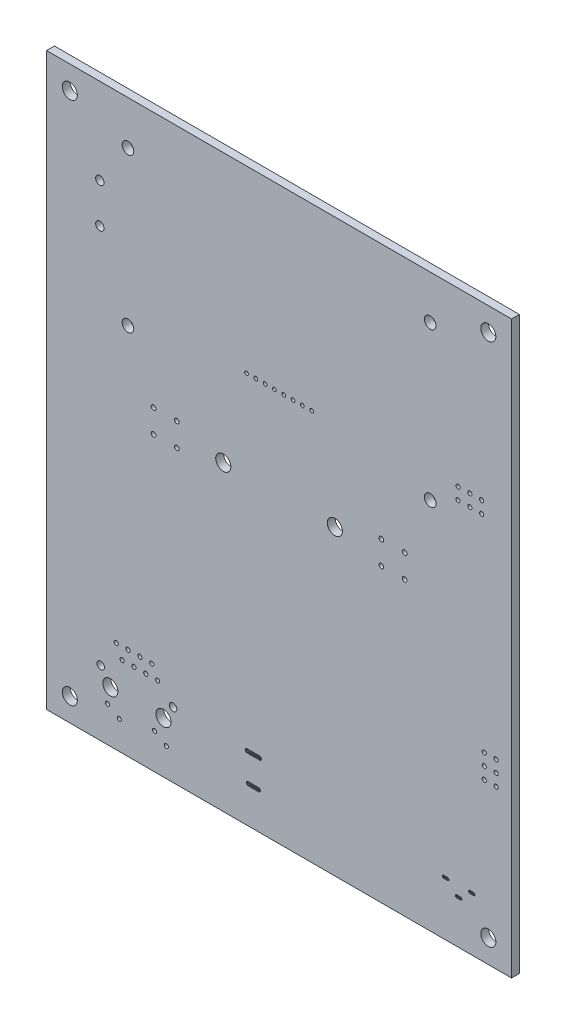
from build123d import *

# Parameters (mm, degrees)
SKETCH1_W           = 100
SKETCH1_H           = 122.75
SKETCH1_R           = 1.62500056
SKETCH1_R_2         = 0.4499991
SKETCH1_R_3         = 1.25000004
SKETCH1_R_4         = 0.3999992
SKETCH1_R_5         = 0.499999
SKETCH1_R_6         = 0.8999982
SKETCH1_R_7         = 0.7999984
SKETCH1_R_8         = 0.44500038
BOSS_EXTRUDE1_DEPTH = 1.69164


with BuildPart() as part:
    # Sketch1 → Boss-Extrude1 (new body)
    with BuildSketch(Plane(origin=(0, 0, 0), x_dir=(-1, 0, 0), z_dir=(0, 0, -1))):
        with Locations((50, 61.375)):
            Rectangle(SKETCH1_W, SKETCH1_H)
        with Locations(Location((4.99999762, 117.75000072, 0), (0, 0, 180))):
            Circle(SKETCH1_R, mode=Mode.SUBTRACT)
        with Locations(Location((6.42639812, 85.78000116, 0), (0, 0, 180))):
            Circle(SKETCH1_R_2, mode=Mode.SUBTRACT)
        with Locations(Location((6.42639812, 83.24000116, 0), (0, 0, 180))):
            Circle(SKETCH1_R_2, mode=Mode.SUBTRACT)
        with Locations(Location((8.96639812, 85.78000116, 0), (0, 0, 180))):
            Circle(SKETCH1_R_2, mode=Mode.SUBTRACT)
        with Locations(Location((11.50639812, 85.78000116, 0), (0, 0, 180))):
            Circle(SKETCH1_R_2, mode=Mode.SUBTRACT)
        with Locations(Location((11.50639812, 83.24000116, 0), (0, 0, 180))):
            Circle(SKETCH1_R_2, mode=Mode.SUBTRACT)
        with Locations(Location((3.32759812, 39.06940116, 0), (0, 0, 180))):
            Circle(SKETCH1_R_2, mode=Mode.SUBTRACT)
        with Locations(Location((5.86759812, 39.06940116, 0), (0, 0, 180))):
            Circle(SKETCH1_R_2, mode=Mode.SUBTRACT)
        with Locations(Location((3.32759812, 36.52940116, 0), (0, 0, 180))):
            Circle(SKETCH1_R_2, mode=Mode.SUBTRACT)
        with Locations(Location((5.86759812, 36.52940116, 0), (0, 0, 180))):
            Circle(SKETCH1_R_2, mode=Mode.SUBTRACT)
        with Locations(Location((8.96639812, 83.24000116, 0), (0, 0, 180))):
            Circle(SKETCH1_R_2, mode=Mode.SUBTRACT)
        with Locations(Location((5.86759812, 33.98940116, 0), (0, 0, 180))):
            Circle(SKETCH1_R_2, mode=Mode.SUBTRACT)
        with Locations(Location((17.49999802, 113.3500019, 0), (0, 0, 180))):
            Circle(SKETCH1_R_3, mode=Mode.SUBTRACT)
        with Locations(Location((43.00000036, 84.15000188, 0), (0, 0, 180))):
            Circle(SKETCH1_R_4, mode=Mode.SUBTRACT)
        with Locations(Location((44.9999989, 84.15000188, 0), (0, 0, 180))):
            Circle(SKETCH1_R_4, mode=Mode.SUBTRACT)
        with Locations(Location((48.99999852, 84.15000188, 0), (0, 0, 180))):
            Circle(SKETCH1_R_4, mode=Mode.SUBTRACT)
        with Locations(Location((50.9999996, 84.15000188, 0), (0, 0, 180))):
            Circle(SKETCH1_R_4, mode=Mode.SUBTRACT)
        with Locations(Location((46.99999998, 84.15000188, 0), (0, 0, 180))):
            Circle(SKETCH1_R_4, mode=Mode.SUBTRACT)
        with Locations(Location((17.49999802, 80.25000206, 0), (0, 0, 180))):
            Circle(SKETCH1_R_3, mode=Mode.SUBTRACT)
        with Locations(Location((22.99999972, 67.75000166, 0), (0, 0, 180))):
            Circle(SKETCH1_R_5, mode=Mode.SUBTRACT)
        with Locations(Location((22.99999972, 62.7500015, 0), (0, 0, 180))):
            Circle(SKETCH1_R_5, mode=Mode.SUBTRACT)
        with Locations(Location((27.99999988, 67.75000166, 0), (0, 0, 180))):
            Circle(SKETCH1_R_5, mode=Mode.SUBTRACT)
        with Locations(Location((38.0000002, 64.99999954, 0), (0, 0, 180))):
            Circle(SKETCH1_R, mode=Mode.SUBTRACT)
        with Locations(Location((27.99999988, 62.7500015, 0), (0, 0, 180))):
            Circle(SKETCH1_R_5, mode=Mode.SUBTRACT)
        with Locations(Location((3.32759812, 33.98940116, 0), (0, 0, 180))):
            Circle(SKETCH1_R_2, mode=Mode.SUBTRACT)
        with Locations(Location((4.99999762, 5.00000016, 0), (0, 0, 180))):
            Circle(SKETCH1_R, mode=Mode.SUBTRACT)
        with Locations(Location((54.99999922, 84.15000188, 0), (0, 0, 180))):
            Circle(SKETCH1_R_4, mode=Mode.SUBTRACT)
        with Locations(Location((57.0000003, 84.15000188, 0), (0, 0, 180))):
            Circle(SKETCH1_R_4, mode=Mode.SUBTRACT)
        with Locations(Location((53.00000068, 84.15000188, 0), (0, 0, 180))):
            Circle(SKETCH1_R_4, mode=Mode.SUBTRACT)
        with Locations(Location((71.99999824, 67.75000166, 0), (0, 0, 180))):
            Circle(SKETCH1_R_5, mode=Mode.SUBTRACT)
        with Locations(Location((76.9999984, 67.75000166, 0), (0, 0, 180))):
            Circle(SKETCH1_R_5, mode=Mode.SUBTRACT)
        with Locations(Location((62.00000046, 64.99999954, 0), (0, 0, 180))):
            Circle(SKETCH1_R, mode=Mode.SUBTRACT)
        with Locations(Location((71.99999824, 62.7500015, 0), (0, 0, 180))):
            Circle(SKETCH1_R_5, mode=Mode.SUBTRACT)
        with Locations(Location((76.9999984, 62.7500015, 0), (0, 0, 180))):
            Circle(SKETCH1_R_5, mode=Mode.SUBTRACT)
        with Locations(Location((77.39299482, 19.88000088, 0), (0, 0, 180))):
            Circle(SKETCH1_R_2, mode=Mode.SUBTRACT)
        with Locations(Location((76.12299482, 17.34000088, 0), (0, 0, 180))):
            Circle(SKETCH1_R_2, mode=Mode.SUBTRACT)
        with Locations(Location((82.5000001, 80.25000206, 0), (0, 0, 180))):
            Circle(SKETCH1_R_3, mode=Mode.SUBTRACT)
        with Locations(Location((82.5000001, 113.3500019, 0), (0, 0, 180))):
            Circle(SKETCH1_R_3, mode=Mode.SUBTRACT)
        with Locations(Location((79.94299734, 19.88000088, 0), (0, 0, 180))):
            Circle(SKETCH1_R_2, mode=Mode.SUBTRACT)
        with Locations(Location((88.54999816, 104.30000222, 0), (0, 0, 180))):
            Circle(SKETCH1_R_6, mode=Mode.SUBTRACT)
        with Locations(Location((94.99999796, 117.75000072, 0), (0, 0, 180))):
            Circle(SKETCH1_R, mode=Mode.SUBTRACT)
        with Locations(Location((88.54999816, 95.7999989, 0), (0, 0, 180))):
            Circle(SKETCH1_R_6, mode=Mode.SUBTRACT)
        with Locations(Location((81.21299734, 17.34000088, 0), (0, 0, 180))):
            Circle(SKETCH1_R_2, mode=Mode.SUBTRACT)
        with Locations(Location((82.48299734, 19.88000088, 0), (0, 0, 180))):
            Circle(SKETCH1_R_2, mode=Mode.SUBTRACT)
        with Locations(Location((78.66299482, 17.34000088, 0), (0, 0, 180))):
            Circle(SKETCH1_R_2, mode=Mode.SUBTRACT)
        with Locations(Location((85.02299734, 19.88000088, 0), (0, 0, 180))):
            Circle(SKETCH1_R_2, mode=Mode.SUBTRACT)
        with Locations(Location((83.75299734, 17.34000088, 0), (0, 0, 180))):
            Circle(SKETCH1_R_2, mode=Mode.SUBTRACT)
        with Locations(Location((72.79799512, 14.04999984, 0), (0, 0, 180))):
            Circle(SKETCH1_R_7, mode=Mode.SUBTRACT)
        with Locations(Location((86.28799608, 11.00000086, 0), (0, 0, 180))):
            Circle(SKETCH1_R, mode=Mode.SUBTRACT)
        with Locations(Location((88.34799704, 14.04999984, 0), (0, 0, 180))):
            Circle(SKETCH1_R_7, mode=Mode.SUBTRACT)
        with Locations(Location((74.85799608, 11.00000086, 0), (0, 0, 180))):
            Circle(SKETCH1_R, mode=Mode.SUBTRACT)
        with Locations(Location((74.2479973, 6.1000005, 0), (0, 0, 180))):
            Circle(SKETCH1_R_8, mode=Mode.SUBTRACT)
        with Locations(Location((76.7879973, 7.62, 0), (0, 0, 180))):
            Circle(SKETCH1_R_8, mode=Mode.SUBTRACT)
        with Locations(Location((84.35799486, 6.1000005, 0), (0, 0, 180))):
            Circle(SKETCH1_R_8, mode=Mode.SUBTRACT)
        with Locations(Location((86.89799486, 7.62, 0), (0, 0, 180))):
            Circle(SKETCH1_R_8, mode=Mode.SUBTRACT)
        with Locations(Location((94.99999796, 5.00000016, 0), (0, 0, 180))):
            Circle(SKETCH1_R, mode=Mode.SUBTRACT)
        Polygon((7.946000099, 11.777000427), (8.045000076, 11.843999863), (8.161999702, 11.866999626), (8.234000206, 11.852999687), (8.305999756, 11.866999626), (8.381999969, 11.852000237), (8.458000183, 11.866999626), (8.508999825, 11.857000351), (8.56000042, 11.866999626), (8.63599968, 11.852000237), (8.711999893, 11.866999626), (8.776000023, 11.854000092), (8.838999748, 11.866999626), (8.901000023, 11.854999542), (8.961999893, 11.866999626), (9.079000473, 11.843999863), (9.178999901, 11.777000427), (9.244999886, 11.67800045), (9.267999649, 11.56099987), (9.244999886, 11.444000244), (9.178999901, 11.345000267), (9.079000473, 11.279000282), (8.961999893, 11.255000114), (8.901000023, 11.267999649), (8.838999748, 11.255000114), (8.776000023, 11.267999649), (8.711999893, 11.255000114), (8.63599968, 11.270000458), (8.56000042, 11.255000114), (8.508999825, 11.265000343), (8.458000183, 11.255000114), (8.381999969, 11.270000458), (8.305999756, 11.255000114), (8.234000206, 11.270000458), (8.161999702, 11.255000114), (8.045000076, 11.279000282), (7.946000099, 11.345000267), (7.880000114, 11.444000244), (7.856999874, 11.56099987), (7.880000114, 11.67800045), align=None, mode=Mode.SUBTRACT)
        Polygon((13.574000359, 11.777000427), (13.673000336, 11.843999863), (13.789999962, 11.866999626), (13.862000465, 11.852999687), (13.932999611, 11.866999626), (14.010000229, 11.852000237), (14.086000443, 11.866999626), (14.137000084, 11.857000351), (14.187000275, 11.866999626), (14.263999939, 11.852000237), (14.340000153, 11.866999626), (14.402999878, 11.854000092), (14.467000008, 11.866999626), (14.527999878, 11.854999542), (14.590000153, 11.866999626), (14.706999779, 11.843999863), (14.805999756, 11.777000427), (14.871999741, 11.67800045), (14.895999908, 11.56099987), (14.871999741, 11.444000244), (14.805999756, 11.345000267), (14.706999779, 11.279000282), (14.590000153, 11.255000114), (14.527999878, 11.267999649), (14.467000008, 11.255000114), (14.402999878, 11.267999649), (14.340000153, 11.255000114), (14.263999939, 11.270000458), (14.187000275, 11.255000114), (14.137000084, 11.265000343), (14.086000443, 11.255000114), (14.010000229, 11.270000458), (13.932999611, 11.255000114), (13.862000465, 11.270000458), (13.789999962, 11.255000114), (13.673000336, 11.279000282), (13.574000359, 11.345000267), (13.506999969, 11.444000244), (13.484000206, 11.56099987), (13.506999969, 11.67800045), align=None, mode=Mode.SUBTRACT)
        Polygon((11.286000252, 9.63599968), (11.329000473, 9.626999855), (11.387000084, 9.638999939), (11.472000122, 9.621999741), (11.539999962, 9.63599968), (11.602999687, 9.623000145), (11.666999817, 9.63599968), (11.727999687, 9.623000145), (11.789999962, 9.63599968), (11.906999588, 9.612000465), (12.005999565, 9.545999527), (12.07199955, 9.44699955), (12.095999718, 9.329999924), (12.07199955, 9.213000298), (12.005999565, 9.11400032), (11.906999588, 9.046999931), (11.789999962, 9.024000168), (11.727999687, 9.036000252), (11.666999817, 9.024000168), (11.602999687, 9.036999702), (11.539999962, 9.024000168), (11.456000328, 9.041000366), (11.387000084, 9.027000427), (11.345000267, 9.036000252), (11.286000252, 9.024000168), (11.210000038, 9.038999557), (11.133000374, 9.024000168), (11.062000275, 9.038000107), (10.989999771, 9.024000168), (10.873000145, 9.046999931), (10.774000168, 9.11400032), (10.706999779, 9.213000298), (10.684000015, 9.329999924), (10.706999779, 9.44699955), (10.774000168, 9.545999527), (10.873000145, 9.612000465), (10.989999771, 9.63599968), (11.062000275, 9.62100029), (11.133000374, 9.63599968), (11.210000038, 9.62100029), align=None, mode=Mode.SUBTRACT)
        Polygon((55.340000153, 14.234000206), (55.372001648, 14.255000114), (55.527999878, 14.286000252), (55.683998108, 14.255000114), (55.691001892, 14.25), (55.696998596, 14.255000114), (55.853000641, 14.286000252), (56.002998352, 14.255999565), (56.152999878, 14.286000252), (56.308998108, 14.255000114), (56.314998627, 14.25), (56.321998596, 14.255000114), (56.478000641, 14.286000252), (56.633998871, 14.255000114), (56.678001404, 14.225000381), (56.722000122, 14.255000114), (56.877998352, 14.286000252), (57.034000397, 14.255000114), (57.166000366, 14.166000366), (57.255001068, 14.034000397), (57.285999298, 13.878000259), (57.255001068, 13.722000122), (57.166000366, 13.590000153), (57.034000397, 13.501000404), (56.877998352, 13.470000267), (56.722000122, 13.501000404), (56.678001404, 13.531000137), (56.633998871, 13.501000404), (56.478000641, 13.470000267), (56.321998596, 13.501000404), (56.314998627, 13.505999565), (56.308998108, 13.501000404), (56.152999878, 13.470000267), (56.002998352, 13.5), (55.853000641, 13.470000267), (55.696998596, 13.501000404), (55.689998627, 13.505999565), (55.683998108, 13.501000404), (55.527999878, 13.470000267), (55.372001648, 13.501000404), (55.340999603, 13.522000313), (55.308998108, 13.501000404), (55.152999878, 13.470000267), (54.997001648, 13.501000404), (54.990001678, 13.505999565), (54.98400116, 13.501000404), (54.827999115, 13.470000267), (54.672000885, 13.501000404), (54.665000916, 13.505999565), (54.659000397, 13.501000404), (54.502998352, 13.470000267), (54.347000122, 13.501000404), (54.340999603, 13.505999565), (54.333999634, 13.501000404), (54.178001404, 13.470000267), (54.021999359, 13.501000404), (53.88999939, 13.590000153), (53.800998688, 13.722000122), (53.770000458, 13.878000259), (53.800998688, 14.034000397), (53.88999939, 14.166000366), (54.021999359, 14.255000114), (54.178001404, 14.286000252), (54.333999634, 14.255000114), (54.340999603, 14.25), (54.347000122, 14.255000114), (54.502998352, 14.286000252), (54.659000397, 14.255000114), (54.665000916, 14.25), (54.672000885, 14.255000114), (54.827999115, 14.286000252), (54.98400116, 14.255000114), (54.990001678, 14.25), (54.997001648, 14.255000114), (55.152999878, 14.286000252), (55.308998108, 14.255000114), align=None, mode=Mode.SUBTRACT)
        Polygon((54.13999939, 8.166000366), (54.271999359, 8.255000114), (54.428001404, 8.286000252), (54.583999634, 8.255000114), (54.627998352, 8.225000381), (54.672000885, 8.255000114), (54.827999115, 8.286000252), (54.98400116, 8.255000114), (55.01499939, 8.234000206), (55.047000885, 8.255000114), (55.202999115, 8.286000252), (55.35900116, 8.255000114), (55.365001678, 8.25), (55.372001648, 8.255000114), (55.527999878, 8.286000252), (55.683998108, 8.255000114), (55.740001678, 8.217000008), (55.797000885, 8.255000114), (55.952999115, 8.286000252), (56.10900116, 8.255000114), (56.152999878, 8.225000381), (56.196998596, 8.255000114), (56.353000641, 8.286000252), (56.490001678, 8.258000374), (56.627998352, 8.286000252), (56.784000397, 8.255000114), (56.916000366, 8.166000366), (57.005001068, 8.034000397), (57.035999298, 7.877999783), (57.005001068, 7.722000122), (56.916000366, 7.590000153), (56.784000397, 7.500999928), (56.627998352, 7.46999979), (56.490001678, 7.498000145), (56.353000641, 7.46999979), (56.196998596, 7.500999928), (56.152999878, 7.531000137), (56.10900116, 7.500999928), (55.952999115, 7.46999979), (55.797000885, 7.500999928), (55.740001678, 7.539000034), (55.683998108, 7.500999928), (55.527999878, 7.46999979), (55.372001648, 7.500999928), (55.365001678, 7.506000042), (55.35900116, 7.500999928), (55.202999115, 7.46999979), (55.047000885, 7.500999928), (55.01499939, 7.521999836), (54.98400116, 7.500999928), (54.827999115, 7.46999979), (54.672000885, 7.500999928), (54.627998352, 7.531000137), (54.583999634, 7.500999928), (54.428001404, 7.46999979), (54.271999359, 7.500999928), (54.13999939, 7.590000153), (54.050998688, 7.722000122), (54.020000458, 7.877999783), (54.050998688, 8.034000397), align=None, mode=Mode.SUBTRACT)
    extrude(amount=-BOSS_EXTRUDE1_DEPTH)


solid = part.part
